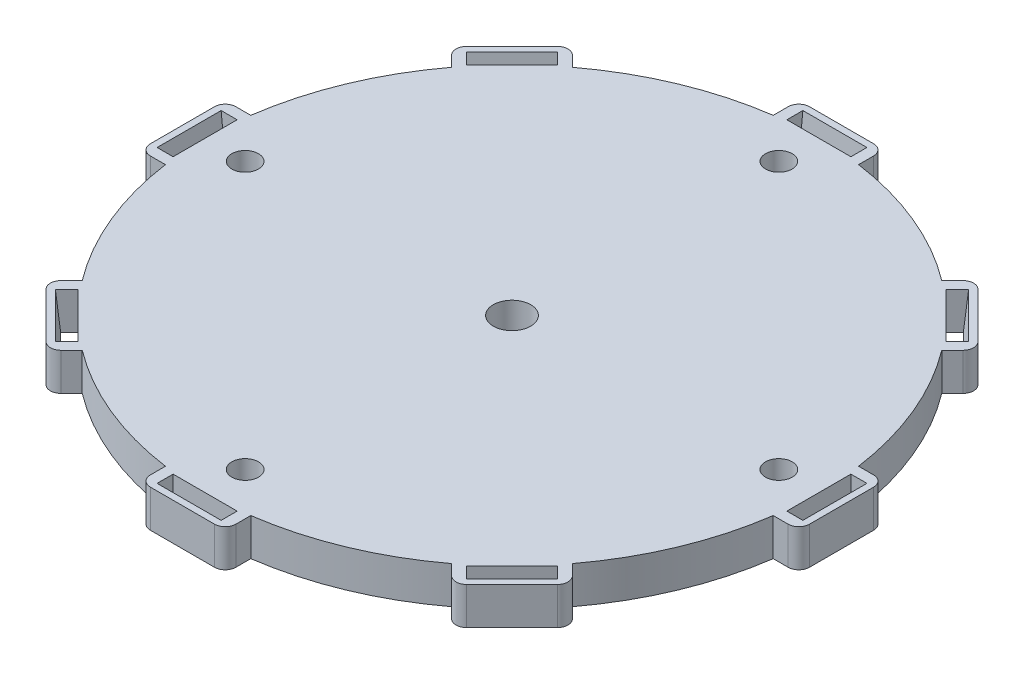
from build123d import *

# Parameters (mm, degrees)
BOSS_EXTRUDE1_DEPTH    = 7
SKETCH2_W              = 5
SKETCH2_H              = 10
BOSS_EXTRUDE2_DEPTH    = 95
SKETCH15_R             = 3.5
CUT_EXTRUDE3_DEPTH     = 7
CIRPATTERN1_COUNT      = 8
SKETCH18_W             = 10
SKETCH18_H             = 5
BOSS_EXTRUDE3_DEPTH    = 34
BOSS_EXTRUDE4_DEPTH    = 10
FILLET1_R              = 2
FILLET2_R              = 2
LPATTERN2_COUNT        = 10
LPATTERN2_PITCH        = 8
FILLET1_OF_LPATTERN2_R = 2
SKETCH20_R             = 2.5
CUT_EXTRUDE4_DEPTH     = 10
CIRPATTERN2_COUNT      = 4
CUT_EXTRUDE7_DEPTH     = 142.792331695


with BuildPart() as part:
    # Sketch1 → Boss-Extrude1 (new body)
    with BuildSketch(Plane(origin=(0, 0, 0), x_dir=(1, 0, 0), z_dir=(0, 1, 0))):
        with BuildLine():
            Line((-8, 56.940758688), (-8, 59.740758688))
            ThreePointArc((-8, 59.740758688), (-7.414213562, 61.154972251), (-6, 61.740758688))
            Line((-6, 61.740758688), (6, 61.740758688))
            ThreePointArc((6, 61.740758688), (7.414213562, 61.154972251), (8, 59.740758688))
            Line((8, 59.740758688), (8, 56.940758688))
            ThreePointArc((8, 56.940758688), (22.004297361, 53.123073119), (34.606342345, 45.920050844))
            Line((34.606342345, 45.920050844), (36.586241332, 47.899949831))
            ThreePointArc((36.586241332, 47.899949831), (38.000454895, 48.485736269), (39.414668457, 47.899949831))
            Line((39.414668457, 47.899949831), (47.899949831, 39.414668457))
            ThreePointArc((47.899949831, 39.414668457), (48.485736269, 38.000454895), (47.899949831, 36.586241332))
            Line((47.899949831, 36.586241332), (45.920050844, 34.606342345))
            ThreePointArc((45.920050844, 34.606342345), (53.123073119, 22.004297361), (56.940758688, 8))
            Line((56.940758688, 8), (59.740758688, 8))
            ThreePointArc((59.740758688, 8), (61.154972251, 7.414213562), (61.740758688, 6))
            Line((61.740758688, 6), (61.740758688, -6))
            ThreePointArc((61.740758688, -6), (61.154972251, -7.414213562), (59.740758688, -8))
            Line((59.740758688, -8), (56.940758688, -8))
            ThreePointArc((56.940758688, -8), (53.123073119, -22.004297361), (45.920050844, -34.606342345))
            Line((45.920050844, -34.606342345), (47.899949831, -36.586241332))
            ThreePointArc((47.899949831, -36.586241332), (48.485736269, -38.000454895), (47.899949831, -39.414668457))
            Line((47.899949831, -39.414668457), (39.414668457, -47.899949831))
            ThreePointArc((39.414668457, -47.899949831), (38.000454895, -48.485736269), (36.586241332, -47.899949831))
            Line((36.586241332, -47.899949831), (34.606342345, -45.920050844))
            ThreePointArc((34.606342345, -45.920050844), (22.004297361, -53.123073119), (8, -56.940758688))
            Line((8, -56.940758688), (8, -59.740758688))
            ThreePointArc((8, -59.740758688), (7.414213562, -61.154972251), (6, -61.740758688))
            Line((6, -61.740758688), (-6, -61.740758688))
            ThreePointArc((-6, -61.740758688), (-7.414213562, -61.154972251), (-8, -59.740758688))
            Line((-8, -59.740758688), (-8, -56.940758688))
            ThreePointArc((-8, -56.940758688), (-22.004297361, -53.123073119), (-34.606342345, -45.920050844))
            Line((-34.606342345, -45.920050844), (-36.586241332, -47.899949831))
            ThreePointArc((-36.586241332, -47.899949831), (-38.000454895, -48.485736269), (-39.414668457, -47.899949831))
            Line((-39.414668457, -47.899949831), (-47.899949831, -39.414668457))
            ThreePointArc((-47.899949831, -39.414668457), (-48.485736269, -38.000454895), (-47.899949831, -36.586241332))
            Line((-47.899949831, -36.586241332), (-45.920050844, -34.606342345))
            ThreePointArc((-45.920050844, -34.606342345), (-53.123073119, -22.004297361), (-56.940758688, -8))
            Line((-56.940758688, -8), (-59.740758688, -8))
            ThreePointArc((-59.740758688, -8), (-61.154972251, -7.414213562), (-61.740758688, -6))
            Line((-61.740758688, -6), (-61.740758688, 6))
            ThreePointArc((-61.740758688, 6), (-61.154972251, 7.414213562), (-59.740758688, 8))
            Line((-59.740758688, 8), (-56.940758688, 8))
            ThreePointArc((-56.940758688, 8), (-53.123073119, 22.004297361), (-45.920050844, 34.606342345))
            Line((-45.920050844, 34.606342345), (-47.899949831, 36.586241332))
            ThreePointArc((-47.899949831, 36.586241332), (-48.485736269, 38.000454895), (-47.899949831, 39.414668457))
            Line((-47.899949831, 39.414668457), (-39.414668457, 47.899949831))
            ThreePointArc((-39.414668457, 47.899949831), (-38.000454895, 48.485736269), (-36.586241332, 47.899949831))
            Line((-36.586241332, 47.899949831), (-34.606342345, 45.920050844))
            ThreePointArc((-34.606342345, 45.920050844), (-22.004297361, 53.123073119), (-8, 56.940758688))
        make_face()
    extrude(amount=BOSS_EXTRUDE1_DEPTH)

    # Sketch2 → Boss-Extrude2 (add)
    with BuildSketch(Plane(origin=(0, 7, 0), x_dir=(1, 0, 0), z_dir=(0, 1, 0))):
        with Locations((19.5, 10)):
            Rectangle(SKETCH2_W, SKETCH2_H)
        with Locations((-19.5, 10)):
            Rectangle(SKETCH2_W, SKETCH2_H)
    extrude(amount=BOSS_EXTRUDE2_DEPTH)

    # Sketch15 → Cut-Extrude3 (cut)
    with BuildSketch(Plane.XZ):
        with Locations(Location((0, 0, 0), (0, 0, 270))):
            Circle(SKETCH15_R)
    extrude(amount=-CUT_EXTRUDE3_DEPTH, mode=Mode.SUBTRACT)

    # Sketch16 → Cut-Loft2 section 0
    with BuildSketch(Plane.XZ):
        with BuildLine():
            Line((-6, 59.8), (6, 59.8))
            Line((6, 59.8), (6, 57.5))
            Line((6, 57.5), (-6, 57.5))
            Line((-6, 57.5), (-6, 59.8))
        make_face()
    # Sketch17 → Cut-Loft2 section 1
    with BuildSketch(Plane(origin=(0, 7, 0), x_dir=(1, 0, 0), z_dir=(0, 1, 0))):
        with BuildLine():
            Line((-6, -57.5), (6, -57.5))
            Line((6, -57.5), (6, -60.5))
            Line((6, -60.5), (-6, -60.5))
            Line((-6, -60.5), (-6, -57.5))
        make_face()
    cut_loft2 = loft(mode=Mode.SUBTRACT)

    # CirPattern1: Cut-Loft2 ×8 about axis
    cirpattern1_axis = Axis((0, 0, 0), (0, 1, 0))
    for i in range(1, CIRPATTERN1_COUNT):
        add(cut_loft2.rotate(cirpattern1_axis, i * 360 / CIRPATTERN1_COUNT), mode=Mode.SUBTRACT)

    # Sketch18 → Boss-Extrude3 (add)
    with BuildSketch(Plane(origin=(-17, 0, 0), x_dir=(0, 0, -1), z_dir=(1, 0, 0))):
        with Locations((10, 99.5)):
            Rectangle(SKETCH18_W, SKETCH18_H)
    extrude(amount=BOSS_EXTRUDE3_DEPTH)

    # Sketch19 → Boss-Extrude4 (add)
    with BuildSketch(Plane(origin=(0, 0, -15), x_dir=(-1, 0, 0), z_dir=(0, 0, -1))):
        with BuildLine():
            Line((-17, 93), (-11.04472309, 92.26878394))
            ThreePointArc((-11.04472309, 92.26878394), (-9.922197884, 91), (-11.04472309, 89.73121606))
            Line((-11.04472309, 89.73121606), (-17, 89))
            Line((-17, 89), (-17, 93))
        make_face()
    boss_extrude4 = extrude(amount=-BOSS_EXTRUDE4_DEPTH)

    # Fillet1
    fillet1_edges = [part.edges().sort_by_distance(p)[0] for p in [
        (17, 89, -10),
        (17, 93, -10),
    ]]
    fillet(fillet1_edges, radius=FILLET1_R)

    # Fillet2
    fillet2_edges = [part.edges().sort_by_distance(p)[0] for p in [
        (22, 102, -10),
        (-22, 102, -10),
        (-17, 97, -10),
        (17, 97, -10),
    ]]
    fillet(fillet2_edges, radius=FILLET2_R)

    # LPattern2: Boss-Extrude4 ×10
    with Locations(*[(0, -i * LPATTERN2_PITCH, 0) for i in range(1, LPATTERN2_COUNT)]):
        add(boss_extrude4)

    # Fillet1 of LPattern2
    fillet1_of_lpattern2_edges = [part.edges().sort_by_distance(p)[0] for p in [
        (17, 81, -10),
        (17, 85, -10),
        (17, 73, -10),
        (17, 77, -10),
        (17, 65, -10),
        (17, 69, -10),
        (17, 57, -10),
        (17, 61, -10),
        (17, 49, -10),
        (17, 53, -10),
        (17, 41, -10),
        (17, 45, -10),
        (17, 33, -10),
        (17, 37, -10),
        (17, 25, -10),
        (17, 29, -10),
        (17, 17, -10),
        (17, 21, -10),
    ]]
    fillet(fillet1_of_lpattern2_edges, radius=FILLET1_OF_LPATTERN2_R)

    # Sketch20 → Cut-Extrude4 (cut)
    with BuildSketch(Plane(origin=(0, 7, 0), x_dir=(1, 0, 0), z_dir=(0, 1, 0))):
        with Locations(Location((0, 50, 0), (0, 0, 270))):
            Circle(SKETCH20_R)
    cut_extrude4 = extrude(amount=-CUT_EXTRUDE4_DEPTH, mode=Mode.SUBTRACT)

    # CirPattern2: Cut-Extrude4 ×4 about axis
    cirpattern2_axis = Axis((0, 0, 0), (0, 1, 0))
    for i in range(1, CIRPATTERN2_COUNT):
        add(cut_extrude4.rotate(cirpattern2_axis, i * 360 / CIRPATTERN2_COUNT), mode=Mode.SUBTRACT)

    # Sketch22 → Cut-Extrude7 (cut, through all)
    with BuildSketch(Plane(origin=(0, 0, -15), x_dir=(-1, 0, 0), z_dir=(0, 0, -1))):
        with BuildLine():
            Line((20, 102), (-20, 102))
            ThreePointArc((-20, 102), (-21.414213562, 101.414213562), (-22, 100))
            Line((-22, 100), (-22, 7))
            Line((-22, 7), (-17, 7))
            Line((-17, 7), (-17, 15.230549471))
            ThreePointArc((-17, 15.230549471), (-16.497911442, 16.555789567), (-15.243738687, 17.215641774))
            Line((-15.243738687, 17.215641774), (-11.04472309, 17.73121606))
            ThreePointArc((-11.04472309, 17.73121606), (-9.922197884, 19), (-11.04472309, 20.26878394))
            Line((-11.04472309, 20.26878394), (-15.243738687, 20.784358226))
            ThreePointArc((-15.243738687, 20.784358226), (-16.497911442, 21.444210433), (-17, 22.769450529))
            Line((-17, 22.769450529), (-17, 23.230549471))
            ThreePointArc((-17, 23.230549471), (-16.497911442, 24.555789567), (-15.243738687, 25.215641774))
            Line((-15.243738687, 25.215641774), (-11.04472309, 25.73121606))
            ThreePointArc((-11.04472309, 25.73121606), (-9.922197884, 27), (-11.04472309, 28.26878394))
            Line((-11.04472309, 28.26878394), (-15.243738687, 28.784358226))
            ThreePointArc((-15.243738687, 28.784358226), (-16.497911442, 29.444210433), (-17, 30.769450529))
            Line((-17, 30.769450529), (-17, 31.230549471))
            ThreePointArc((-17, 31.230549471), (-16.497911442, 32.555789567), (-15.243738687, 33.215641774))
            Line((-15.243738687, 33.215641774), (-11.04472309, 33.73121606))
            ThreePointArc((-11.04472309, 33.73121606), (-9.922197884, 35), (-11.04472309, 36.26878394))
            Line((-11.04472309, 36.26878394), (-15.243738687, 36.784358226))
            ThreePointArc((-15.243738687, 36.784358226), (-16.497911442, 37.444210433), (-17, 38.769450529))
            Line((-17, 38.769450529), (-17, 39.230549471))
            ThreePointArc((-17, 39.230549471), (-16.497911442, 40.555789567), (-15.243738687, 41.215641774))
            Line((-15.243738687, 41.215641774), (-11.04472309, 41.73121606))
            ThreePointArc((-11.04472309, 41.73121606), (-9.922197884, 43), (-11.04472309, 44.26878394))
            Line((-11.04472309, 44.26878394), (-15.243738687, 44.784358226))
            ThreePointArc((-15.243738687, 44.784358226), (-16.497911442, 45.444210433), (-17, 46.769450529))
            Line((-17, 46.769450529), (-17, 47.230549471))
            ThreePointArc((-17, 47.230549471), (-16.497911442, 48.555789567), (-15.243738687, 49.215641774))
            Line((-15.243738687, 49.215641774), (-11.04472309, 49.73121606))
            ThreePointArc((-11.04472309, 49.73121606), (-9.922197884, 51), (-11.04472309, 52.26878394))
            Line((-11.04472309, 52.26878394), (-15.243738687, 52.784358226))
            ThreePointArc((-15.243738687, 52.784358226), (-16.497911442, 53.444210433), (-17, 54.769450529))
            Line((-17, 54.769450529), (-17, 55.230549471))
            ThreePointArc((-17, 55.230549471), (-16.497911442, 56.555789567), (-15.243738687, 57.215641774))
            Line((-15.243738687, 57.215641774), (-11.04472309, 57.73121606))
            ThreePointArc((-11.04472309, 57.73121606), (-9.922197884, 59), (-11.04472309, 60.26878394))
            Line((-11.04472309, 60.26878394), (-15.243738687, 60.784358226))
            ThreePointArc((-15.243738687, 60.784358226), (-16.497911442, 61.444210433), (-17, 62.769450529))
            Line((-17, 62.769450529), (-17, 63.230549471))
            ThreePointArc((-17, 63.230549471), (-16.497911442, 64.555789567), (-15.243738687, 65.215641774))
            Line((-15.243738687, 65.215641774), (-11.04472309, 65.73121606))
            ThreePointArc((-11.04472309, 65.73121606), (-9.922197884, 67), (-11.04472309, 68.26878394))
            Line((-11.04472309, 68.26878394), (-15.243738687, 68.784358226))
            ThreePointArc((-15.243738687, 68.784358226), (-16.497911442, 69.444210433), (-17, 70.769450529))
            Line((-17, 70.769450529), (-17, 71.230549471))
            ThreePointArc((-17, 71.230549471), (-16.497911442, 72.555789567), (-15.243738687, 73.215641774))
            Line((-15.243738687, 73.215641774), (-11.04472309, 73.73121606))
            ThreePointArc((-11.04472309, 73.73121606), (-9.922197884, 75), (-11.04472309, 76.26878394))
            Line((-11.04472309, 76.26878394), (-15.243738687, 76.784358226))
            ThreePointArc((-15.243738687, 76.784358226), (-16.497911442, 77.444210433), (-17, 78.769450529))
            Line((-17, 78.769450529), (-17, 79.230549471))
            ThreePointArc((-17, 79.230549471), (-16.497911442, 80.555789567), (-15.243738687, 81.215641774))
            Line((-15.243738687, 81.215641774), (-11.04472309, 81.73121606))
            ThreePointArc((-11.04472309, 81.73121606), (-9.922197884, 83), (-11.04472309, 84.26878394))
            Line((-11.04472309, 84.26878394), (-15.243738687, 84.784358226))
            ThreePointArc((-15.243738687, 84.784358226), (-16.497911442, 85.444210433), (-17, 86.769450529))
            Line((-17, 86.769450529), (-17, 87.230549471))
            ThreePointArc((-17, 87.230549471), (-16.497911442, 88.555789567), (-15.243738687, 89.215641774))
            Line((-15.243738687, 89.215641774), (-11.04472309, 89.73121606))
            ThreePointArc((-11.04472309, 89.73121606), (-9.922197884, 91), (-11.04472309, 92.26878394))
            Line((-11.04472309, 92.26878394), (-15.243738687, 92.784358226))
            ThreePointArc((-15.243738687, 92.784358226), (-16.497911442, 93.444210433), (-17, 94.769450529))
            Line((-17, 94.769450529), (-17, 95))
            ThreePointArc((-17, 95), (-16.414213562, 96.414213562), (-15, 97))
            Line((-15, 97), (15, 97))
            ThreePointArc((15, 97), (16.414213562, 96.414213562), (17, 95))
            Line((17, 95), (17, 7))
            Line((17, 7), (22, 7))
            Line((22, 7), (22, 100))
            ThreePointArc((22, 100), (21.414213562, 101.414213562), (20, 102))
        make_face()
    extrude(amount=-CUT_EXTRUDE7_DEPTH, mode=Mode.SUBTRACT)


solid = part.part
